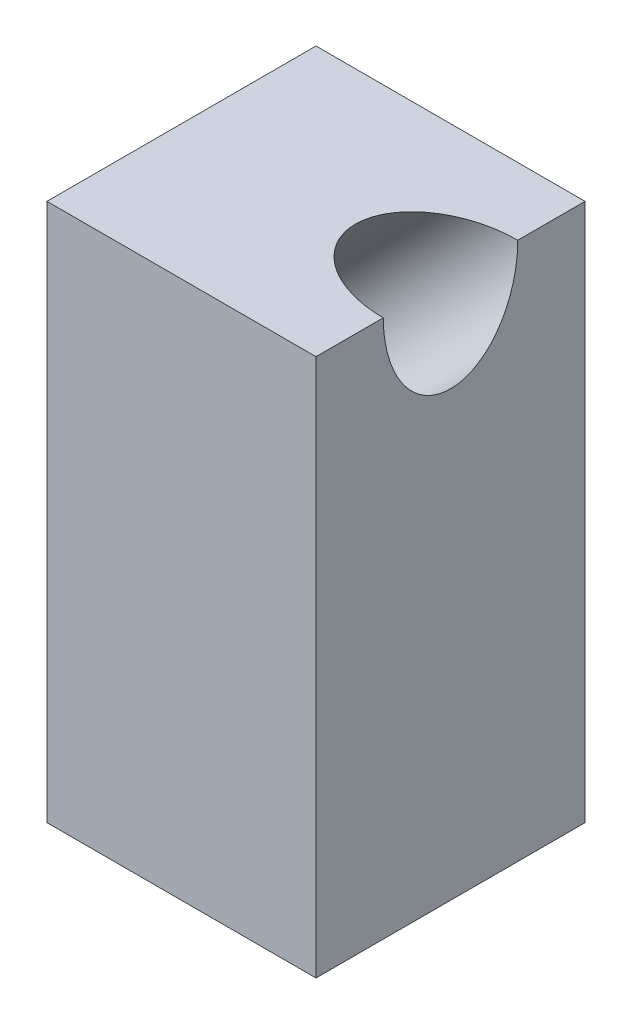
from build123d import *

# Parameters (mm, degrees)
SKETCH1_W           = 25.4
SKETCH1_H           = 50.8
BOSS_EXTRUDE1_DEPTH = 25.4
SKETCH2_R           = 6.35
CUT_EXTRUDE1_DEPTH  = 50.8


with BuildPart() as part:
    # Sketch1 → Boss-Extrude1 (new body)
    with BuildSketch(Plane.XY):
        with Locations((12.7, 25.4)):
            Rectangle(SKETCH1_W, SKETCH1_H)
    extrude(amount=BOSS_EXTRUDE1_DEPTH)

    # Sketch2 → Cut-Extrude1 (cut)
    with BuildSketch(Plane(origin=(38.1, 38.1, 0), x_dir=(0.7071067811865477, -0.7071067811865475, 0), z_dir=(0.7071067811865475, 0.7071067811865477, 0))):
        with Locations(Location((-17.960512242, -12.7, 0), (0, 0, 180))):
            Circle(SKETCH2_R)
    extrude(amount=-CUT_EXTRUDE1_DEPTH, mode=Mode.SUBTRACT)


solid = part.part
